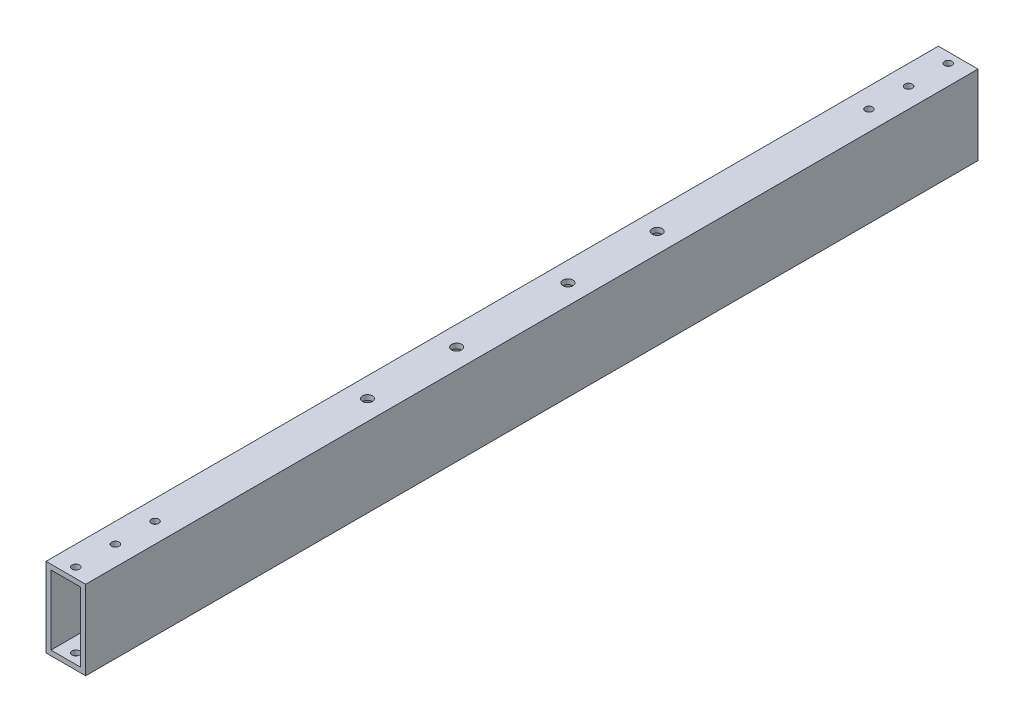
from build123d import *

# Parameters (mm, degrees)
SKETCH1_W                      = 25.4
SKETCH1_H                      = 50.8
SKETCH1_W_2                    = 19.05
SKETCH1_H_2                    = 44.45
EXTRUDE_THIN1_DEPTH            = 571.5
F_3_16_0_1875_DIAMETER_HOLE1_D = 4.7625
F_1_4_0_25_DIAMETER_HOLE1_D    = 6.35
E_0_25_DIAMETER_HOLE1_D        = 6.35
E_0_25_DIAMETER_HOLE1_DEPTH    = 6.35
E_0_25_DIAMETER_HOLE1_TIP      = 1.907732465


with BuildPart() as part:
    # Sketch1 → Extrude-Thin1 (new body)
    with BuildSketch(Plane.XY):
        Rectangle(SKETCH1_W, SKETCH1_H)
        Rectangle(SKETCH1_W_2, SKETCH1_H_2, mode=Mode.SUBTRACT)
    extrude(amount=EXTRUDE_THIN1_DEPTH)

    # 3/16 (0.1875) Diameter Hole1 (through all)
    with Locations(Plane(origin=(0, 25.4, 565.15), x_dir=(0, 0, 1), z_dir=(0, 1, 0))):
        with Locations((0, 0), (-558.8, 0), (-533.4, 0), (-508, 0), (-25.4, 0), (-50.8, 0)):
            Hole(F_3_16_0_1875_DIAMETER_HOLE1_D / 2)

    # 1/4 (0.25) Diameter Hole1 (through all)
    with Locations(Plane(origin=(0, 25.4, 0), x_dir=(1, 0, 0), z_dir=(0, 1, 0))):
        with Locations((0, -321.183), (0, -378.333), (0, -192.786), (0, -249.936)):
            Hole(F_1_4_0_25_DIAMETER_HOLE1_D / 2)

    # E (0.25) Diameter Hole1
    with Locations(Plane.ZY.offset(12.7)):
        with Locations((103.886, 17.145), (103.886, 1.27), (116.586, 8.89), (454.914, 8.89), (467.614, 1.27), (467.614, 17.145)):
            Hole(E_0_25_DIAMETER_HOLE1_D / 2, depth=E_0_25_DIAMETER_HOLE1_DEPTH)
            with Locations((0, 0, -(E_0_25_DIAMETER_HOLE1_DEPTH + E_0_25_DIAMETER_HOLE1_TIP / 2))):  # 118° drill point
                Cone(0, E_0_25_DIAMETER_HOLE1_D / 2, E_0_25_DIAMETER_HOLE1_TIP, mode=Mode.SUBTRACT)


solid = part.part
